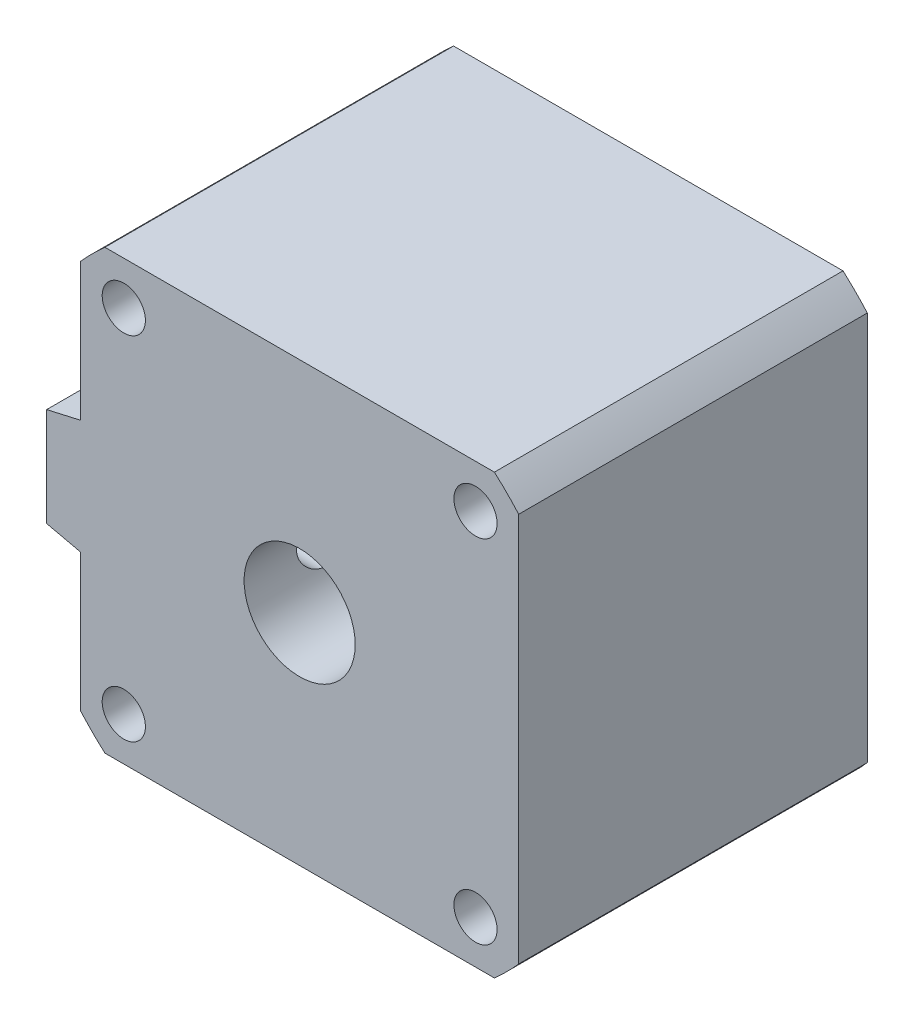
from build123d import *

# Parameters (mm, degrees)
SKETCH_1_W          = 142
SKETCH_1_H          = 142
EXTRUDE_1_DEPTH     = 113
SKETCH_2_R          = 7
CUT_EXTRUDE_1_DEPTH = 113
SKETCH_3_R          = 18
CUT_EXTRUDE_2_DEPTH = 103
SKETCH_4_OUTSIDE_W  = 190.086
SKETCH_4_OUTSIDE_H  = 190.086
SKETCH_4_OUTSIDE_R  = 95
CUT_EXTRUDE_3_DEPTH = 231.427862899
EXTRUDE_2_DEPTH     = 113
SKETCH_6_R          = 7.5
CUT_EXTRUDE_4_DEPTH = 113


with BuildPart() as part:
    # 草图1 → 拉伸1 (new body)
    with BuildSketch(Plane.XY):
        with Locations((71, -71)):
            Rectangle(SKETCH_1_W, SKETCH_1_H)
    extrude(amount=EXTRUDE_1_DEPTH)

    # 草图2 → 切除-拉伸1 (cut)
    with BuildSketch(Plane.XY.offset(113)):
        with Locations((14, -14)):
            Circle(SKETCH_2_R)
        with Locations((128, -14)):
            Circle(SKETCH_2_R)
        with Locations((14, -128)):
            Circle(SKETCH_2_R)
        with Locations((128, -128)):
            Circle(SKETCH_2_R)
    extrude(amount=-CUT_EXTRUDE_1_DEPTH, mode=Mode.SUBTRACT)

    # 草图3 → 切除-拉伸2 (cut)
    with BuildSketch(Plane.XY.offset(113)):
        with Locations((71, -71)):
            Circle(SKETCH_3_R)
    extrude(amount=-CUT_EXTRUDE_2_DEPTH, mode=Mode.SUBTRACT)

    # 草图4 outside → 切除-拉伸3 (cut, through all)
    with BuildSketch(Plane(origin=(0, 0, 0), x_dir=(-1, 0, 0), z_dir=(0, 0, -1))):
        with Locations((-71, -71)):
            Rectangle(SKETCH_4_OUTSIDE_W, SKETCH_4_OUTSIDE_H)
        with Locations((-71, -71)):
            Circle(SKETCH_4_OUTSIDE_R, mode=Mode.SUBTRACT)
    extrude(amount=-CUT_EXTRUDE_3_DEPTH, mode=Mode.SUBTRACT)

    # 草图5 → 拉伸2 (add)
    with BuildSketch(Plane(origin=(0, 0, 0), x_dir=(-1, 0, 0), z_dir=(0, 0, -1))):
        Polygon((11, -55), (0, -52.5), (0, -55), (0, -87), (0, -89.5), (11, -87), align=None)
    extrude(amount=-EXTRUDE_2_DEPTH)

    # 草图6 → 切除-拉伸4 (cut)
    with BuildSketch(Plane.ZY.offset(11)):
        with Locations(Location((24.5, -71, 0), (0, 0, 270))):
            Circle(SKETCH_6_R)
        with Locations(Location((88.5, -71, 0), (0, 0, 270))):
            Circle(SKETCH_6_R)
    extrude(amount=-CUT_EXTRUDE_4_DEPTH, mode=Mode.SUBTRACT)


solid = part.part
